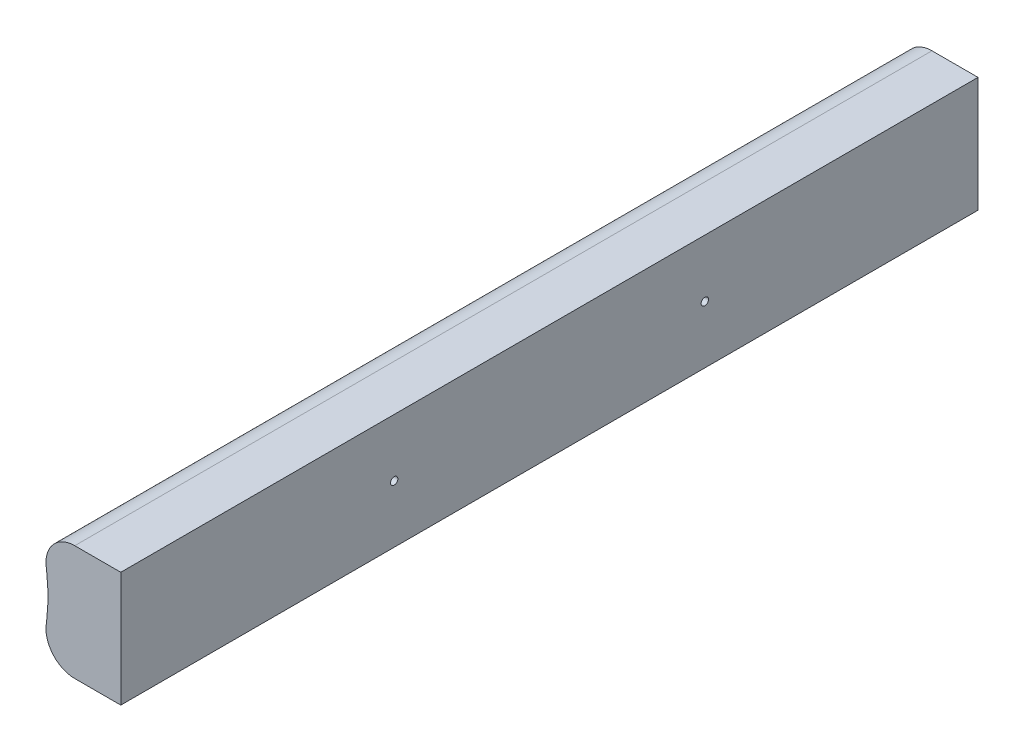
from build123d import *

# Parameters (mm, degrees)
EXTRUDE1_DEPTH               = 473.075
A_0_234_DIAMETER_HOLE1_D     = 8.128
A_0_234_DIAMETER_HOLE1_DEPTH = 19.05
A_0_234_DIAMETER_HOLE1_TIP   = 2.441897556


with BuildPart() as part:
    # Sketch1 → Extrude1 (new, symmetric)
    with BuildSketch(Plane.XY):
        with BuildLine():
            Line((-81.45600692, -19.8133218), (-82.370570719, -28.379308014))
            ThreePointArc((-82.370570719, -28.379308014), (-74.412305802, -52.975492096), (-50.8, -63.5))
            Line((-50.8, -63.5), (0, -63.5))
            Line((0, -63.5), (0, 63.5))
            Line((0, 63.5), (-50.8, 63.5))
            ThreePointArc((-50.8, 63.5), (-74.412305802, 52.975492096), (-82.370570719, 28.379308014))
            Line((-82.370570719, 28.379308014), (-81.45600692, 19.8133218))
            ThreePointArc((-81.45600692, 19.8133218), (-80.401300618, 0), (-81.45600692, -19.8133218))
        make_face()
    extrude(amount=EXTRUDE1_DEPTH, both=True)

    # A (0.234) Diameter Hole1
    with Locations(Plane(origin=(0, 0, 171.323), x_dir=(0, 1, 0), z_dir=(1, 0, 0))):
        with Locations((0, 0), (0, -342.9)):
            Hole(A_0_234_DIAMETER_HOLE1_D / 2, depth=A_0_234_DIAMETER_HOLE1_DEPTH)
            with Locations((0, 0, -(A_0_234_DIAMETER_HOLE1_DEPTH + A_0_234_DIAMETER_HOLE1_TIP / 2))):  # 118° drill point
                Cone(0, A_0_234_DIAMETER_HOLE1_D / 2, A_0_234_DIAMETER_HOLE1_TIP, mode=Mode.SUBTRACT)


solid = part.part
